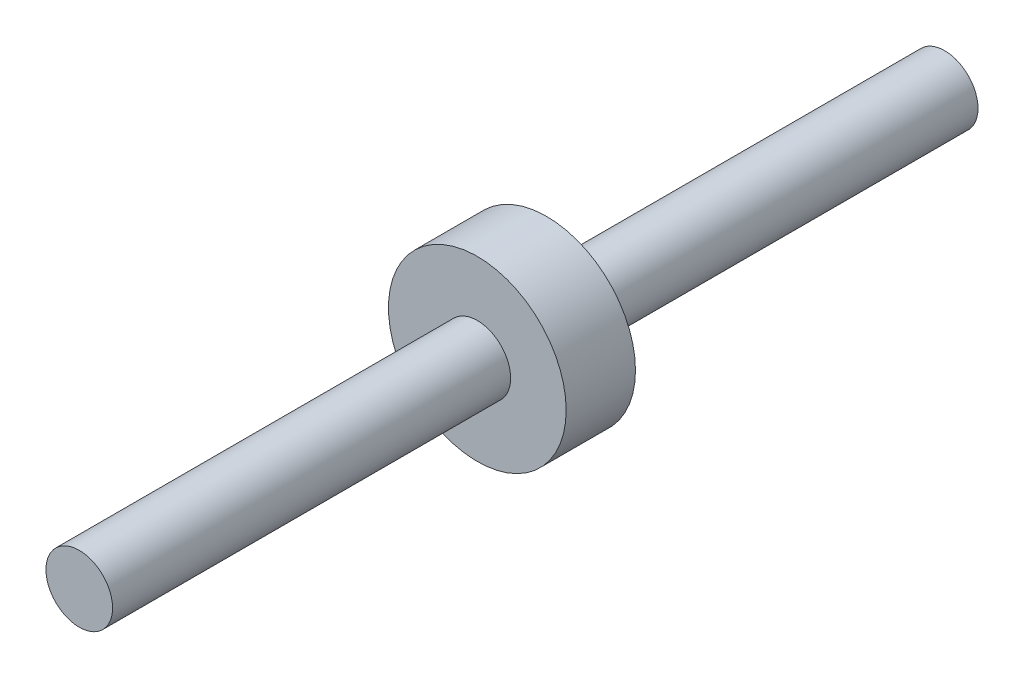
from build123d import *

# Parameters (mm, degrees)
SKETCH1_R           = 4.7625
BOSS_EXTRUDE1_DEPTH = 123.698
SKETCH3_R           = 12.7
BOSS_EXTRUDE2_DEPTH = 4.953


with BuildPart() as part:
    # Sketch1 → Boss-Extrude1 (new body)
    with BuildSketch(Plane.XY):
        Circle(SKETCH1_R)
    extrude(amount=BOSS_EXTRUDE1_DEPTH)

    # Sketch3 → Boss-Extrude2 (add, symmetric)
    with BuildSketch(Plane.XY.offset(61.849)):
        Circle(SKETCH3_R)
    extrude(amount=BOSS_EXTRUDE2_DEPTH, both=True)


solid = part.part
